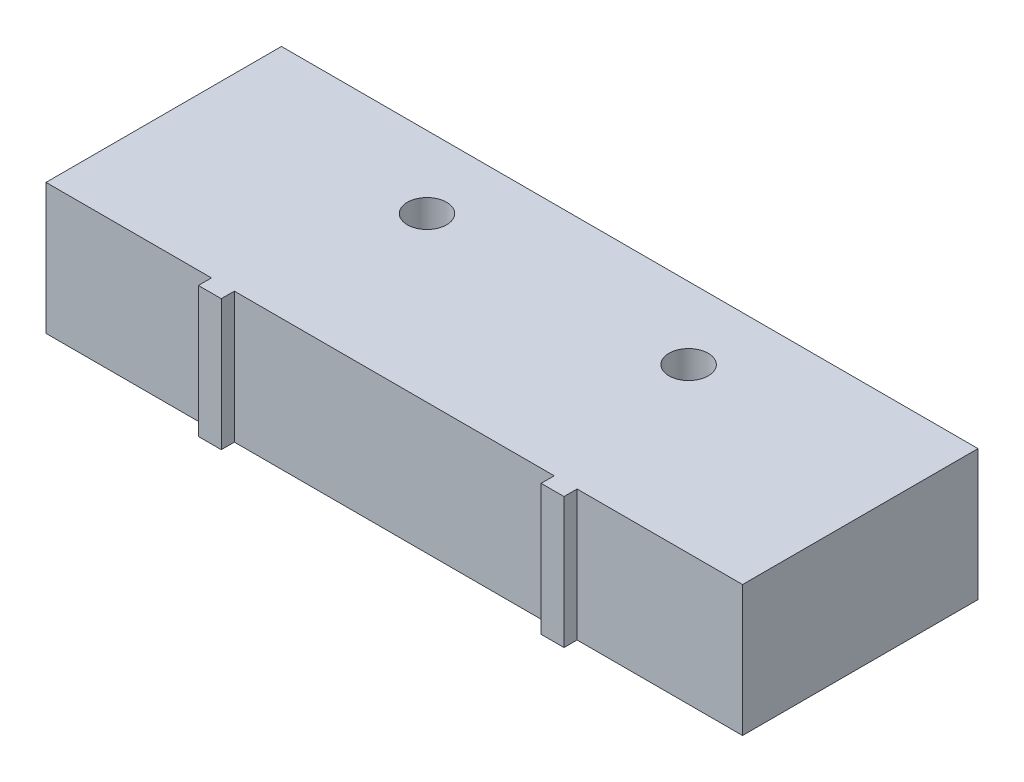
from build123d import *

# Parameters (mm, degrees)
SKETCH1_R           = 3
BOSS_EXTRUDE2_DEPTH = 20


with BuildPart() as part:
    # Sketch1 → Boss-Extrude2 (new body)
    with BuildSketch(Plane(origin=(0, 0, 0), x_dir=(1, 0, 0), z_dir=(0, 1, 0))):
        Polygon((0, 0), (25.3, 0), (25.3, -2), (28.8, -2), (28.8, 0), (77.7, 0), (77.7, -2), (81.2, -2), (81.2, 0), (106.5, 0), (106.5, 36), (0, 36), align=None)
        with Locations(Location((33.25, 25, 0), (0, 0, 270))):
            Circle(SKETCH1_R, mode=Mode.SUBTRACT)
        with Locations(Location((73.25, 25, 0), (0, 0, 90))):
            Circle(SKETCH1_R, mode=Mode.SUBTRACT)
    extrude(amount=BOSS_EXTRUDE2_DEPTH)


solid = part.part
